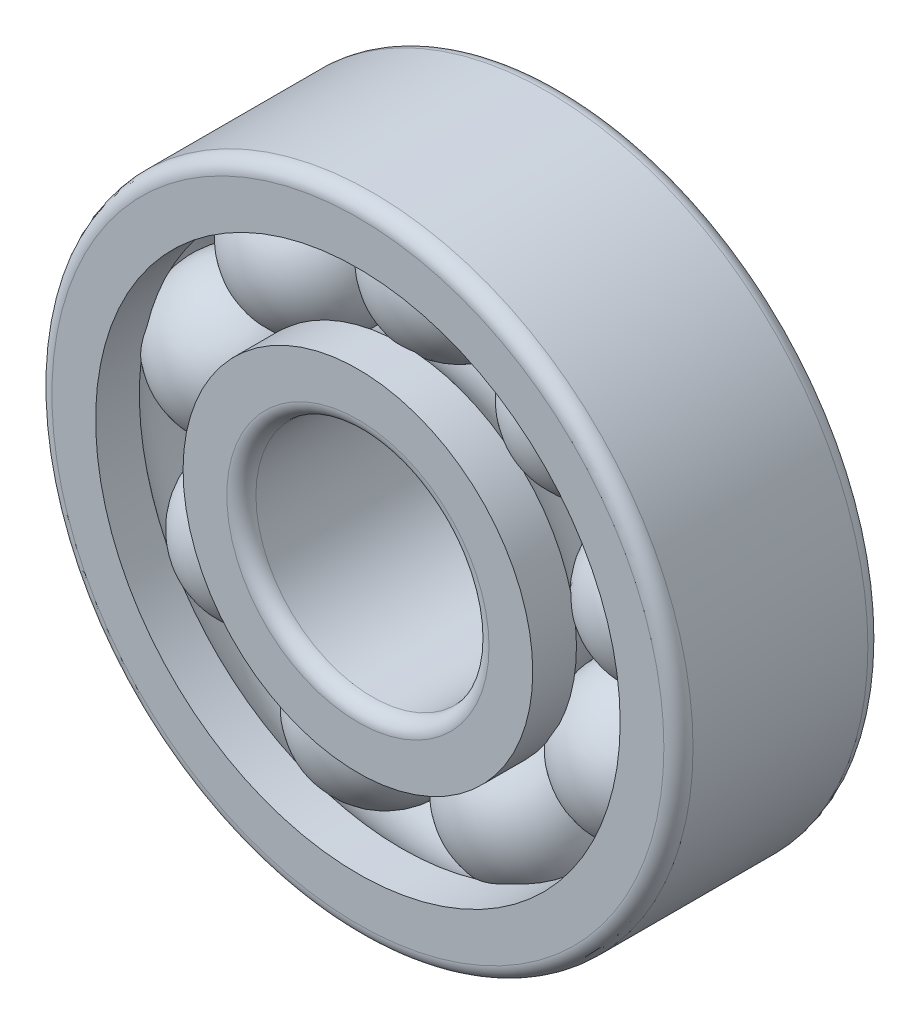
from build123d import *

# Parameters (mm, degrees)
SKETCH1_R             = 6
SKETCH1_R_2           = 4
BOSS_EXTRUDE1_DEPTH   = 3.5
SKETCH1_R_3           = 11
SKETCH1_R_4           = 9
BOSS_EXTRUDE1_2_DEPTH = 3.5
SKETCH2_R             = 2.5
CIRPATTERN1_COUNT     = 9
FILLET3_R             = 0.5


with BuildPart() as part:
    # Sketch1 → Boss-Extrude1 (new, symmetric)
    with BuildSketch(Plane.XY):
        Circle(SKETCH1_R)
        Circle(SKETCH1_R_2, mode=Mode.SUBTRACT)
    extrude(amount=BOSS_EXTRUDE1_DEPTH, both=True)


with BuildPart() as body_2:
    # Sketch1 → Boss-Extrude1 2 (new, symmetric)
    with BuildSketch(Plane.XY):
        Circle(SKETCH1_R_3)
        Circle(SKETCH1_R_4, mode=Mode.SUBTRACT)
    extrude(amount=BOSS_EXTRUDE1_2_DEPTH, both=True)


with BuildPart() as cut_revolve1_tool:
    # Sketch2 → Cut-Revolve1 (revolve)
    with BuildSketch(Plane(origin=(0, 0, 0), x_dir=(0, 0, -1), z_dir=(1, 0, 0))):
        with Locations((0, 7.5)):
            Circle(SKETCH2_R)
    revolve(axis=Axis((0, 0, 0), (0, 0, -1)))


with BuildPart() as part_1:
    add(part.part)

    # Cut-Revolve1: cut by cut_revolve1_tool
    add(cut_revolve1_tool.part, mode=Mode.SUBTRACT)



with BuildPart() as body_2_1:
    add(body_2.part)

    # Cut-Revolve1: cut by cut_revolve1_tool
    add(cut_revolve1_tool.part, mode=Mode.SUBTRACT)


with BuildPart() as part_2:
    add(part_1.part)

    add(body_2_1.part)  # Revolve1 merges body 2
    # Sketch4 → Revolve1 (revolve)
    with BuildSketch(Plane(origin=(0, 0, 0), x_dir=(0, 0, -1), z_dir=(1, 0, 0))):
        with BuildLine():
            Line((-2.55, 7.5), (2.55, 7.5))
            ThreePointArc((2.55, 7.5), (0, 10.05), (-2.55, 7.5))
        make_face()
    revolve1 = revolve(axis=Axis((0, 7.5, 0), (0, 0, -1)))

    # CirPattern1: Revolve1 ×9 about axis
    cirpattern1_axis = Axis((0, 0, 0), (0, 0, 1))
    for i in range(1, CIRPATTERN1_COUNT):
        add(revolve1.rotate(cirpattern1_axis, i * 360 / CIRPATTERN1_COUNT))

    # Fillet3
    fillet3_edges = [part_2.edges().sort_by_distance(p)[0] for p in [
        (-11, 0, -3.5),
        (-11, 0, 3.5),
        (-4, 0, -3.5),
        (-4, 0, 3.5),
    ]]
    fillet(fillet3_edges, radius=FILLET3_R)


solid = part_2.part
